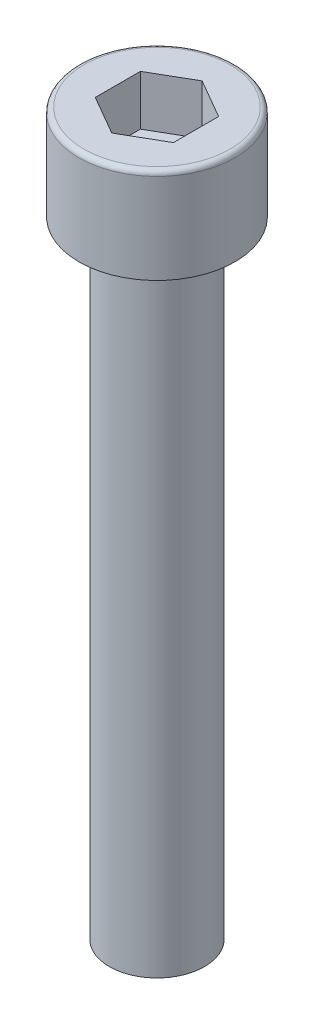
from build123d import *

# Parameters (mm, degrees)
SKETCH1_R   = 2.413
SHAFT_DEPTH = 31.75
SKETCH2_R   = 3.9624
HEAD_DEPTH  = 4.826
FILLET1_R   = 0.254
HEX_2_DEPTH = 2.54


with BuildPart() as part:
    # Sketch1 → Shaft (new body)
    with BuildSketch(Plane(origin=(0, 0, 0), x_dir=(1, 0, 0), z_dir=(0, 1, 0))):
        with Locations(Location((0, 0, 0), (0, 0, 270))):
            Circle(SKETCH1_R)
    extrude(amount=-SHAFT_DEPTH)

    # Sketch2 → Head (add)
    with BuildSketch(Plane(origin=(0, 0, 0), x_dir=(1, 0, 0), z_dir=(0, 1, 0))):
        with Locations(Location((0, 0, 0), (0, 0, 270))):
            Circle(SKETCH2_R)
    extrude(amount=HEAD_DEPTH)

    # Fillet1
    fillet1_edges = [part.edges().sort_by_distance(p)[0] for p in [
        (0, 4.826, -3.9624),
    ]]
    fillet(fillet1_edges, radius=FILLET1_R)

    # Sketch3 → Hex 2 (cut)
    with BuildSketch(Plane(origin=(0, 4.826, 0), x_dir=(1, 0, 0), z_dir=(0, 1, 0))):
        Polygon((0, 2.291358881), (-1.984375, 1.14567944), (-1.984375, -1.14567944), (0, -2.291358881), (1.984375, -1.14567944), (1.984375, 1.14567944), align=None)
    extrude(amount=-HEX_2_DEPTH, mode=Mode.SUBTRACT)


solid = part.part
